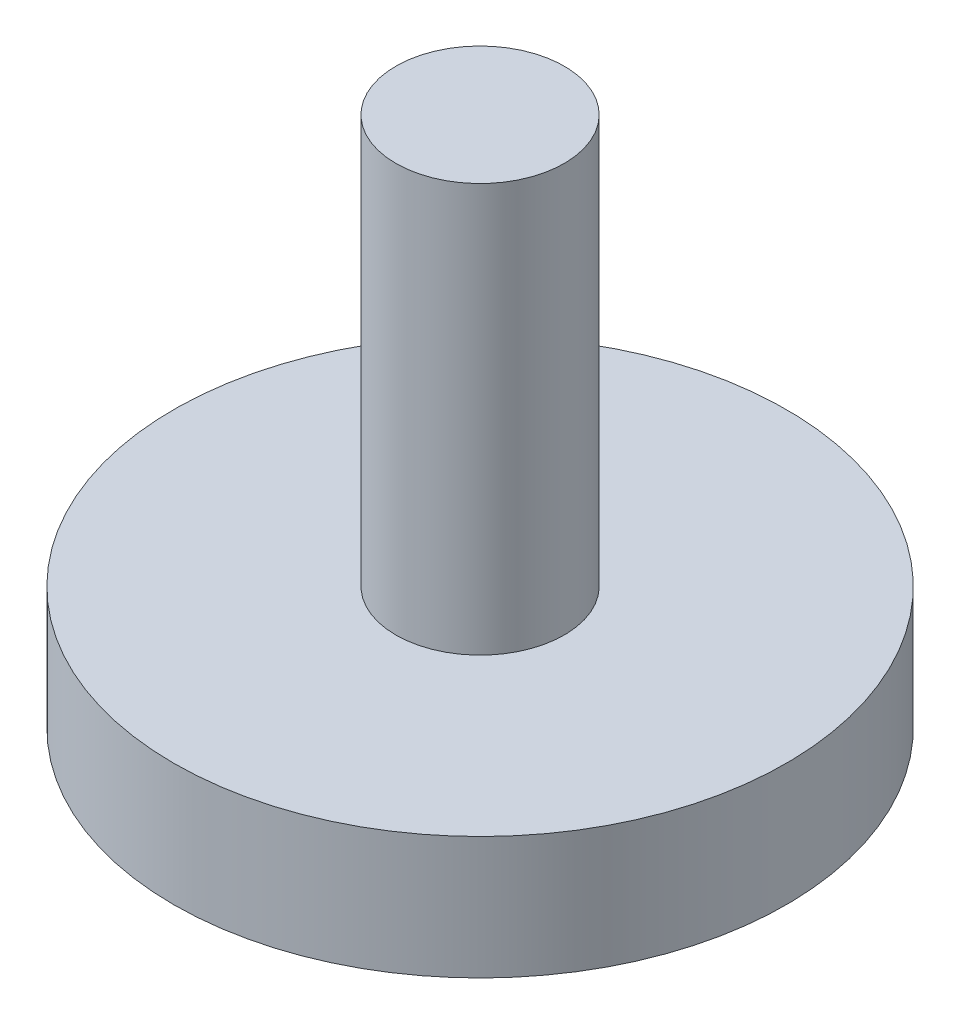
from build123d import *

# Parameters (mm, degrees)
SKETCH_1_R      = 7.5
EXTRUDE_1_DEPTH = 3
SKETCH_2_R      = 2.0625
EXTRUDE_2_DEPTH = 10


with BuildPart() as part:
    # 스케치1 → 보스-돌출1 (new body)
    with BuildSketch(Plane(origin=(0, 0, 0), x_dir=(1, 0, 0), z_dir=(0, 1, 0))):
        with Locations(Location((0, 0, 0), (0, 0, 270))):
            Circle(SKETCH_1_R)
    extrude(amount=EXTRUDE_1_DEPTH)

    # 스케치2 → 보스-돌출2 (add)
    with BuildSketch(Plane(origin=(0, 3, 0), x_dir=(1, 0, 0), z_dir=(0, 1, 0))):
        with Locations(Location((0, 0, 0), (0, 0, 270))):
            Circle(SKETCH_2_R)
    extrude(amount=EXTRUDE_2_DEPTH)


solid = part.part
